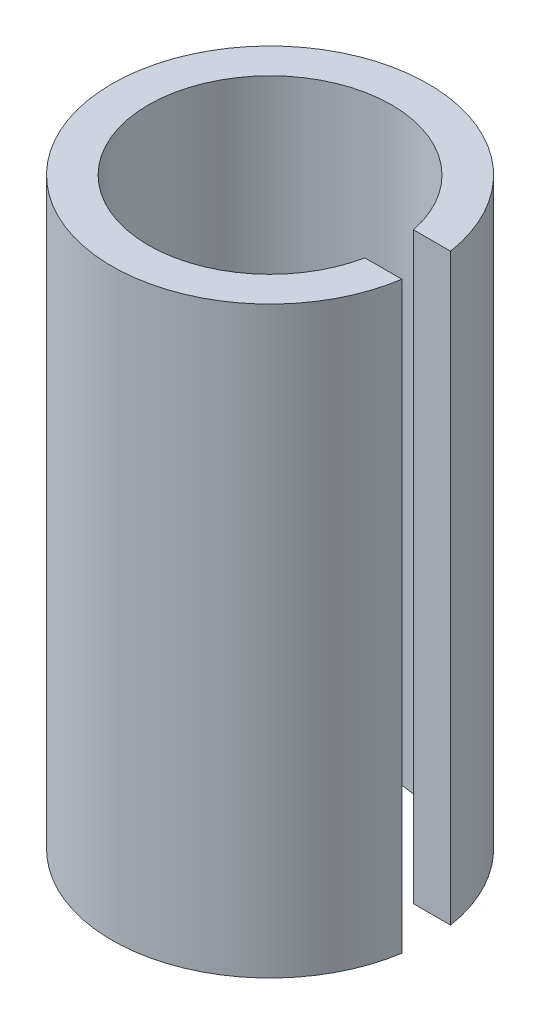
from build123d import *

# Parameters (mm, degrees)
BOSS_EXTRUDE1_DEPTH = 12


with BuildPart() as part:
    # Sketch1 → Boss-Extrude1 (new body)
    with BuildSketch(Plane(origin=(0, 0, 0), x_dir=(1, 0, 0), z_dir=(0, 1, 0))):
        with BuildLine():
            ThreePointArc((2.449489743, -0.5), (-2.5, 0), (2.449489743, 0.5))
            Line((2.449489743, 0.5), (3.211308145, 0.5))
            ThreePointArc((3.211308145, 0.5), (-3.25, 0), (3.211308145, -0.5))
            Line((3.211308145, -0.5), (2.449489743, -0.5))
        make_face()
    extrude(amount=BOSS_EXTRUDE1_DEPTH)


solid = part.part
